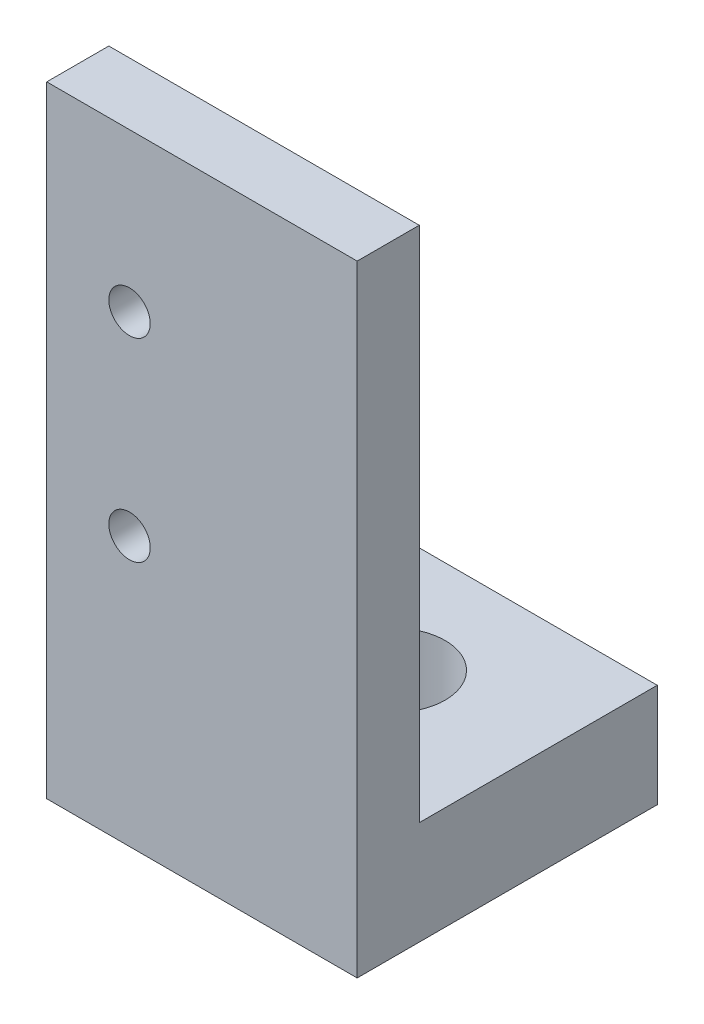
from build123d import *

# Parameters (mm, degrees)
CROQUIS1_W              = 16
CROQUIS1_H              = 11.5
CROQUIS1_R              = 2.5
CROQUIS1_H_2            = 3
SALIENTE_EXTRUIR1_DEPTH = 5
CROQUIS4_W              = 16
CROQUIS4_H              = 3
SALIENTE_EXTRUIR3_DEPTH = 25
CROQUIS6_R              = 1
CORTAR_EXTRUIR1_DEPTH   = 25
CROQUIS7_W              = 1
CROQUIS7_H              = 30
CORTAR_EXTRUIR2_DEPTH   = 25


with BuildPart() as part:
    # Croquis1 → Saliente-Extruir1 (new body)
    # profile 1 of 2: a face of its own
    with BuildSketch(Plane(origin=(0, 0, 0), x_dir=(1, 0, 0), z_dir=(0, 1, 0))):
        Rectangle(CROQUIS1_W, CROQUIS1_H)
        with Locations(Location((0, 0, 0), (0, 0, 270))):
            Circle(CROQUIS1_R, mode=Mode.SUBTRACT)
    # profile 2 of 2: a face of its own
    with BuildSketch(Plane(origin=(0, 0, 0), x_dir=(1, 0, 0), z_dir=(0, 1, 0))):
        with Locations((0, -7.25)):
            Rectangle(CROQUIS1_W, CROQUIS1_H_2)
    extrude(amount=SALIENTE_EXTRUIR1_DEPTH)

    # Croquis4 → Saliente-Extruir3 (add)
    with BuildSketch(Plane(origin=(0, 5, 0), x_dir=(1, 0, 0), z_dir=(0, 1, 0))):
        with Locations((0, -7.25)):
            Rectangle(CROQUIS4_W, CROQUIS4_H)
    extrude(amount=SALIENTE_EXTRUIR3_DEPTH)

    # Croquis6 → Cortar-Extruir1 (cut)
    with BuildSketch(Plane.XY.offset(8.75)):
        with Locations((-4, 22.38)):
            Circle(CROQUIS6_R)
        with Locations((-4, 13)):
            Circle(CROQUIS6_R)
    extrude(amount=-CORTAR_EXTRUIR1_DEPTH, mode=Mode.SUBTRACT)

    # Croquis7 → Cortar-Extruir2 (cut)
    with BuildSketch(Plane.XY.offset(8.75)):
        with Locations((7.5, 15)):
            Rectangle(CROQUIS7_W, CROQUIS7_H)
    extrude(amount=-CORTAR_EXTRUIR2_DEPTH, mode=Mode.SUBTRACT)


solid = part.part
